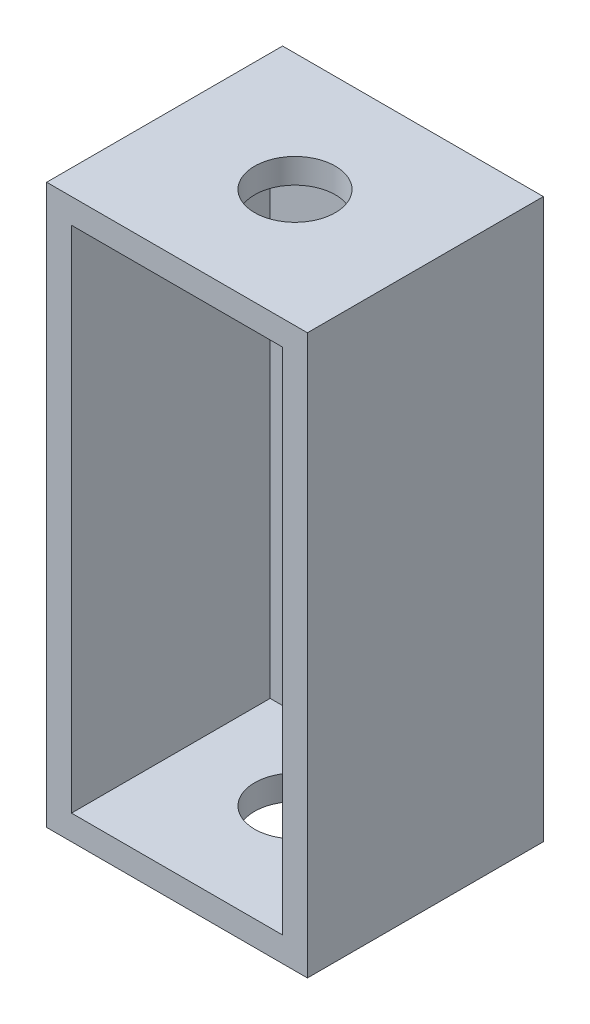
from build123d import *

# Parameters (mm, degrees)
SKETCH_1_W                = 42
SKETCH_1_H                = 90
HOUSING_ENVELOPE_DEPTH    = 38
SKETCH_2_W                = 34
SKETCH_2_H                = 82
FRONT_ACCESS_WINDOW_DEPTH = 32
SKETCH_3_R                = 6.5
AXIAL_PASSAGE_DEPTH       = 107.339080304


with BuildPart() as part:
    # 草图1 → Housing_envelope (new body)
    with BuildSketch(Plane.XY):
        with Locations((21, 45)):
            Rectangle(SKETCH_1_W, SKETCH_1_H)
    extrude(amount=HOUSING_ENVELOPE_DEPTH)

    # 草图2 → Front_access_window (cut)
    with BuildSketch(Plane.XY.offset(38)):
        with Locations((21, 45)):
            Rectangle(SKETCH_2_W, SKETCH_2_H)
    extrude(amount=-FRONT_ACCESS_WINDOW_DEPTH, mode=Mode.SUBTRACT)

    # 草图3 → Axial_passage (cut, through all)
    with BuildSketch(Plane(origin=(0, 90, 0), x_dir=(1, 0, 0), z_dir=(0, 1, 0))):
        with Locations(Location((21, -19, 0), (0, 0, 270))):
            Circle(SKETCH_3_R)
    extrude(amount=-AXIAL_PASSAGE_DEPTH, mode=Mode.SUBTRACT)


solid = part.part
